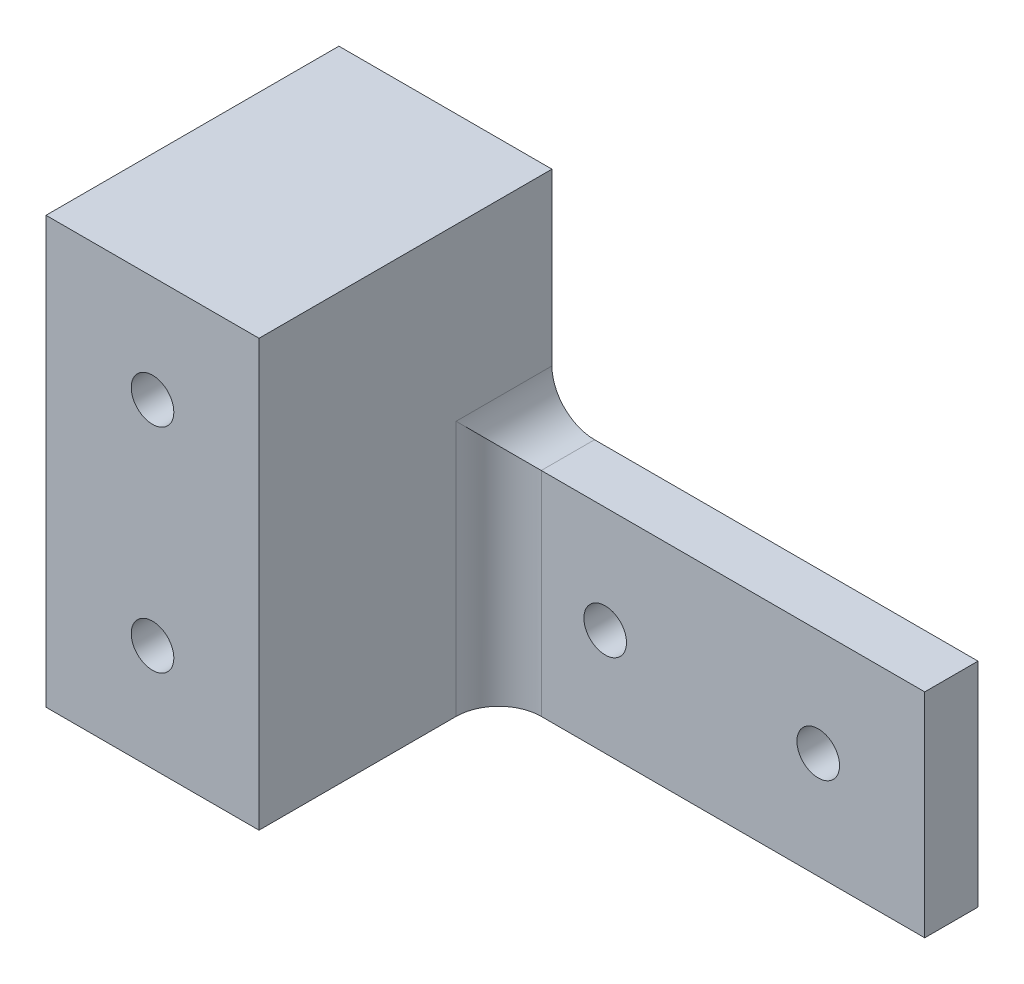
from build123d import *

# Parameters (mm, degrees)
BOSS_EXTRUDE1_DEPTH = 34.925
SKETCH2_R           = 2.54
CUT_EXTRUDE1_DEPTH  = 99.014466407
SKETCH4_W           = 50.8
SKETCH4_H           = 28.575
CUT_EXTRUDE3_DEPTH  = 99.014466407
FILLET1_R           = 5.08
SKETCH5_R           = 6.35
CUT_EXTRUDE4_DEPTH  = 22.225


with BuildPart() as part:
    # Sketch1 → Boss-Extrude1 (new body)
    with BuildSketch(Plane.XY):
        Polygon((0, 0), (0, 50.8), (25.4, 50.8), (25.4, 25.4), (76.2, 25.4), (76.2, 0), align=None)
    extrude(amount=BOSS_EXTRUDE1_DEPTH)

    # Sketch2 → Cut-Extrude1 (cut, through all)
    with BuildSketch(Plane.XY.offset(34.925)):
        with Locations((12.7, 38.1)):
            Circle(SKETCH2_R)
        with Locations((12.7, 12.7)):
            Circle(SKETCH2_R)
        with Locations((38.1, 12.7)):
            Circle(SKETCH2_R)
        with Locations((63.5, 12.7)):
            Circle(SKETCH2_R)
    extrude(amount=-CUT_EXTRUDE1_DEPTH, mode=Mode.SUBTRACT)

    # Sketch4 → Cut-Extrude3 (cut, through all)
    with BuildSketch(Plane.XZ):
        with Locations((50.8, 20.6375)):
            Rectangle(SKETCH4_W, SKETCH4_H)
    extrude(amount=-CUT_EXTRUDE3_DEPTH, mode=Mode.SUBTRACT)

    # Fillet1
    fillet1_edges = [part.edges().sort_by_distance(p)[0] for p in [
        (25.4, 25.4, 3.175),
        (25.4, 12.7, 6.35),
    ]]
    fillet(fillet1_edges, radius=FILLET1_R)

    # Sketch5 → Cut-Extrude4 (cut)
    with BuildSketch(Plane(origin=(0, 0, 0), x_dir=(-1, 0, 0), z_dir=(0, 0, -1))):
        with Locations((-12.7, 38.1)):
            Circle(SKETCH5_R)
    extrude(amount=-CUT_EXTRUDE4_DEPTH, mode=Mode.SUBTRACT)


solid = part.part
